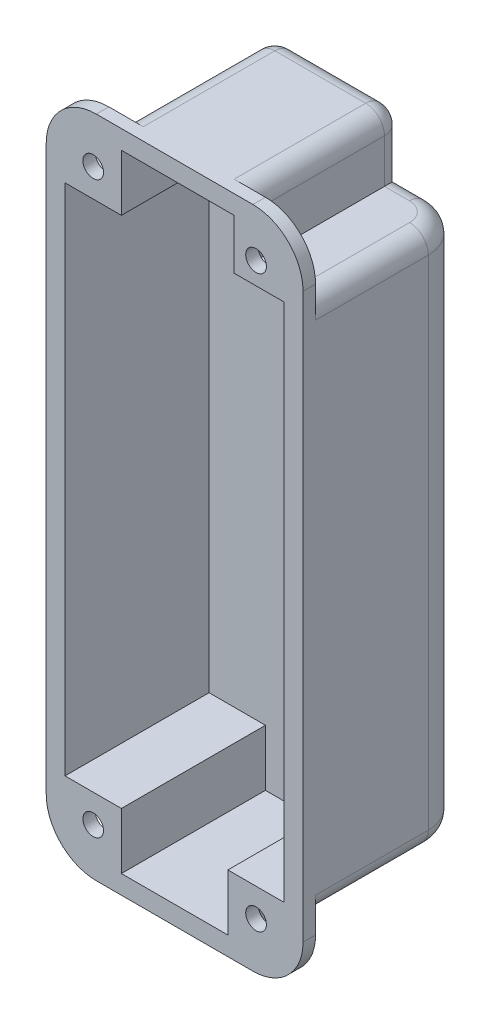
from build123d import *

# Parameters (mm, degrees)
SKETCH_2_W          = 41
SKETCH_2_H          = 106
SKETCH_2_R          = 1.65
EXTRUDE_3_DEPTH     = 23
SKETCH_5_R          = 1.65
CUT_EXTRUDE_2_DEPTH = 113.169514575
SKETCH_6_W          = 41
SKETCH_6_H          = 106
EXTRUDE_4_DEPTH     = 3
CUT_EXTRUDE_START   = -2
SKETCH_7_W          = 10.5
SKETCH_7_H          = 10.5
SKETCH_7_W_2        = 10
SKETCH_7_H_2        = 10
CUT_EXTRUDE_3_DEPTH = 111.822870022
FILLET_1_R          = 8
FILLET_2_R          = 6
FILLET_3_R          = 3


with BuildPart() as part:
    # 草图2 → 凸台-拉伸3 (new body)
    with BuildSketch(Plane.XY):
        with Locations((17.5, 50)):
            Rectangle(SKETCH_2_W, SKETCH_2_H)
        Polygon((9, 0), (9, 9), (0, 9), (0, 91), (9, 91), (9, 100), (27, 100), (27, 92), (35, 92), (35, 9), (26, 9), (26, 0), align=None, mode=Mode.SUBTRACT)
        with Locations((4.5, 4.5)):
            Circle(SKETCH_2_R, mode=Mode.SUBTRACT)
        with Locations((4.5, 95.5)):
            Circle(SKETCH_2_R, mode=Mode.SUBTRACT)
        with Locations((30.5, 95.5)):
            Circle(SKETCH_2_R, mode=Mode.SUBTRACT)
    extrude(amount=EXTRUDE_3_DEPTH)

    # 草图5 → 切除-拉伸2 (cut, through all)
    with BuildSketch(Plane.XY.offset(23)):
        with Locations((30.5, 4.5)):
            Circle(SKETCH_5_R)
    extrude(amount=-CUT_EXTRUDE_2_DEPTH, mode=Mode.SUBTRACT)

    # 草图6 → 凸台-拉伸4 (add)
    with BuildSketch(Plane(origin=(0, 0, 0), x_dir=(-1, 0, 0), z_dir=(0, 0, -1))):
        with Locations((-17.5, 50)):
            Rectangle(SKETCH_6_W, SKETCH_6_H)
    extrude(amount=EXTRUDE_4_DEPTH)

    # 草图7 → 切除-拉伸3 (cut, through all)
    with BuildSketch(Plane.XY.offset(23).offset(CUT_EXTRUDE_START)):
        with Locations((2.25, 97.75)):
            Rectangle(SKETCH_7_W, SKETCH_7_H)
        with Locations((33, 98)):
            Rectangle(SKETCH_7_W_2, SKETCH_7_H_2)
        with Locations((2.25, 2.25)):
            Rectangle(SKETCH_7_W, SKETCH_7_H)
        with Locations((32.75, 2.25)):
            Rectangle(SKETCH_7_W, SKETCH_7_H)
    extrude(amount=-CUT_EXTRUDE_3_DEPTH, mode=Mode.SUBTRACT)

    # 圆角1
    fillet_1_edges = [part.edges().sort_by_distance(p)[0] for p in [
        (-3, -3, 22),
        (-3, 103, 22),
        (38, 103, 22),
        (38, -3, 22),
    ]]
    fillet(fillet_1_edges, radius=FILLET_1_R)

    # 圆角2
    fillet_2_edges = [part.edges().sort_by_distance(p)[0] for p in [
        (38, 50.25, -3),
        (-3, 50, -3),
    ]]
    fillet(fillet_2_edges, radius=FILLET_2_R)

    # 圆角3
    fillet_3_edges = [part.edges().sort_by_distance(p)[0] for p in [
        (17.5, -3, -3),
        (17.75, 103, -3),
        (27.5, -3, 9),
        (27.5, 2.25, -3),
        (7.5, 103, 9),
        (7.5, 97.75, -3),
        (28, 98, -3),
        (28, 103, 9),
        (7.5, 2.25, -3),
        (7.5, -3, 9),
        (29.75, 7.5, -3),
        (5.25, 7.5, -3),
        (5.25, 92.5, -3),
        (30, 93, -3),
        (-3, 92.5, 12),
        (-1.242640687, 92.5, -1.242640687),
        (-3, 7.5, 12),
        (-1.242640687, 7.5, -1.242640687),
        (38, 7.5, 12),
        (36.242640687, 7.5, -1.242640687),
        (38, 93, 12),
        (36.242640687, 93, -1.242640687),
    ]]
    fillet(fillet_3_edges, radius=FILLET_3_R)


solid = part.part
